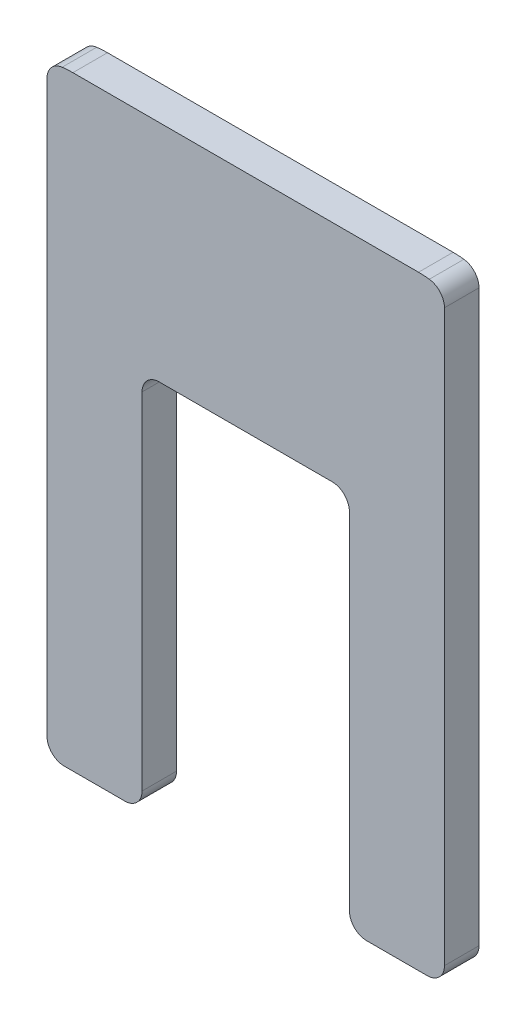
from build123d import *

# Parameters (mm, degrees)
BOSS_EXTRUDE1_DEPTH = 2
FILLET2_R           = 1
SKETCH2_W           = 12
SKETCH2_H           = 22
CUT_EXTRUDE1_DEPTH  = 10
FILLET3_R           = 1


with BuildPart() as part:
    # Sketch1 → Boss-Extrude1 (new body)
    with BuildSketch(Plane.XY):
        with BuildLine():
            Line((0, 0), (23, 0))
            Line((23, 0), (23, 34.769696007))
            ThreePointArc((23, 34.769696007), (22.258788496, 34.942088629), (21.5, 35))
            Line((21.5, 35), (1.5, 35))
            ThreePointArc((1.5, 35), (0.741211504, 34.942088629), (0, 34.769696007))
            Line((0, 34.769696007), (0, 0))
        make_face()
    extrude(amount=BOSS_EXTRUDE1_DEPTH)

    # Fillet2
    fillet2_edges = [part.edges().sort_by_distance(p)[0] for p in [
        (0, 34.769696007, 1),
        (23, 34.769696007, 1),
        (23, 0, 1),
        (0, 0, 1),
    ]]
    fillet(fillet2_edges, radius=FILLET2_R)

    # Sketch2 → Cut-Extrude1 (cut)
    with BuildSketch(Plane.XY.offset(2)):
        with Locations((11.5, 11)):
            Rectangle(SKETCH2_W, SKETCH2_H)
    extrude(amount=-CUT_EXTRUDE1_DEPTH, mode=Mode.SUBTRACT)

    # Fillet3
    fillet3_edges = [part.edges().sort_by_distance(p)[0] for p in [
        (5.5, 0, 1),
        (5.5, 22, 1),
        (17.5, 22, 1),
        (17.5, 0, 1),
    ]]
    fillet(fillet3_edges, radius=FILLET3_R)


solid = part.part
